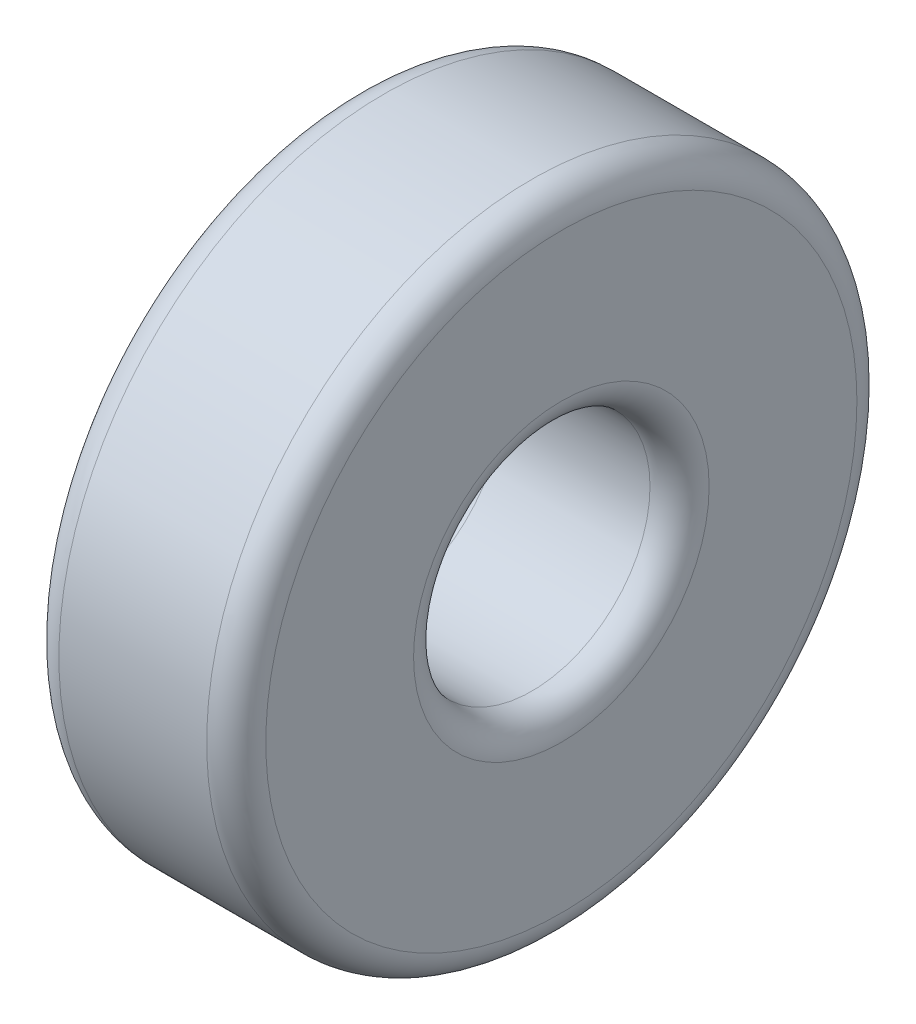
from build123d import *

# Parameters (mm, degrees)
SKETCH_1_R      = 11
SKETCH_1_R_2    = 4
EXTRUDE_1_DEPTH = 7
FILLET_1_R      = 1


with BuildPart() as part:
    # 草图1 → 凸台-拉伸1 (new body)
    with BuildSketch(Plane(origin=(0, 0, 0), x_dir=(0, 0, -1), z_dir=(1, 0, 0))):
        Circle(SKETCH_1_R)
        Circle(SKETCH_1_R_2, mode=Mode.SUBTRACT)
    extrude(amount=EXTRUDE_1_DEPTH)

    # 圆角1
    fillet_1_edges = [part.edges().sort_by_distance(p)[0] for p in [
        (0, 0, 11),
        (7, 0, 11),
        (0, 0, 4),
        (7, 0, 4),
    ]]
    fillet(fillet_1_edges, radius=FILLET_1_R)


solid = part.part
